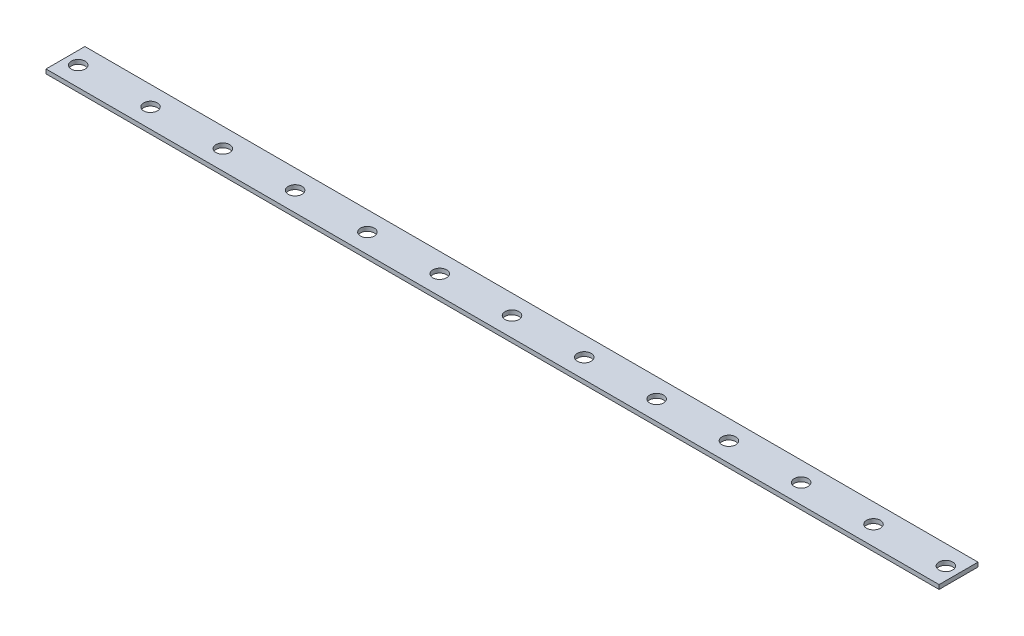
from build123d import *

# Parameters (mm, degrees)
SKETCH1_W           = 420
SKETCH1_H           = 18.3
SKETCH1_R           = 3.25
BOSS_EXTRUDE1_DEPTH = 1


with BuildPart() as part:
    # Sketch1 → Boss-Extrude1 (new, symmetric)
    with BuildSketch(Plane(origin=(0, 0, 0), x_dir=(1, 0, 0), z_dir=(0, 1, 0))):
        Rectangle(SKETCH1_W, SKETCH1_H)
        with Locations(Location((-204, 0, 0), (0, 0, 270))):
            Circle(SKETCH1_R, mode=Mode.SUBTRACT)
        with Locations(Location((-170, 0, 0), (0, 0, 270))):
            Circle(SKETCH1_R, mode=Mode.SUBTRACT)
        with Locations(Location((-136, 0, 0), (0, 0, 270))):
            Circle(SKETCH1_R, mode=Mode.SUBTRACT)
        with Locations(Location((-102, 0, 0), (0, 0, 270))):
            Circle(SKETCH1_R, mode=Mode.SUBTRACT)
        with Locations(Location((-68, 0, 0), (0, 0, 270))):
            Circle(SKETCH1_R, mode=Mode.SUBTRACT)
        with Locations(Location((-34, 0, 0), (0, 0, 270))):
            Circle(SKETCH1_R, mode=Mode.SUBTRACT)
        with Locations(Location((0, 0, 0), (0, 0, 270))):
            Circle(SKETCH1_R, mode=Mode.SUBTRACT)
        with Locations(Location((34, 0, 0), (0, 0, 270))):
            Circle(SKETCH1_R, mode=Mode.SUBTRACT)
        with Locations(Location((68, 0, 0), (0, 0, 270))):
            Circle(SKETCH1_R, mode=Mode.SUBTRACT)
        with Locations(Location((102, 0, 0), (0, 0, 270))):
            Circle(SKETCH1_R, mode=Mode.SUBTRACT)
        with Locations(Location((136, 0, 0), (0, 0, 270))):
            Circle(SKETCH1_R, mode=Mode.SUBTRACT)
        with Locations(Location((170, 0, 0), (0, 0, 270))):
            Circle(SKETCH1_R, mode=Mode.SUBTRACT)
        with Locations(Location((204, 0, 0), (0, 0, 270))):
            Circle(SKETCH1_R, mode=Mode.SUBTRACT)
    extrude(amount=BOSS_EXTRUDE1_DEPTH, both=True)


solid = part.part
